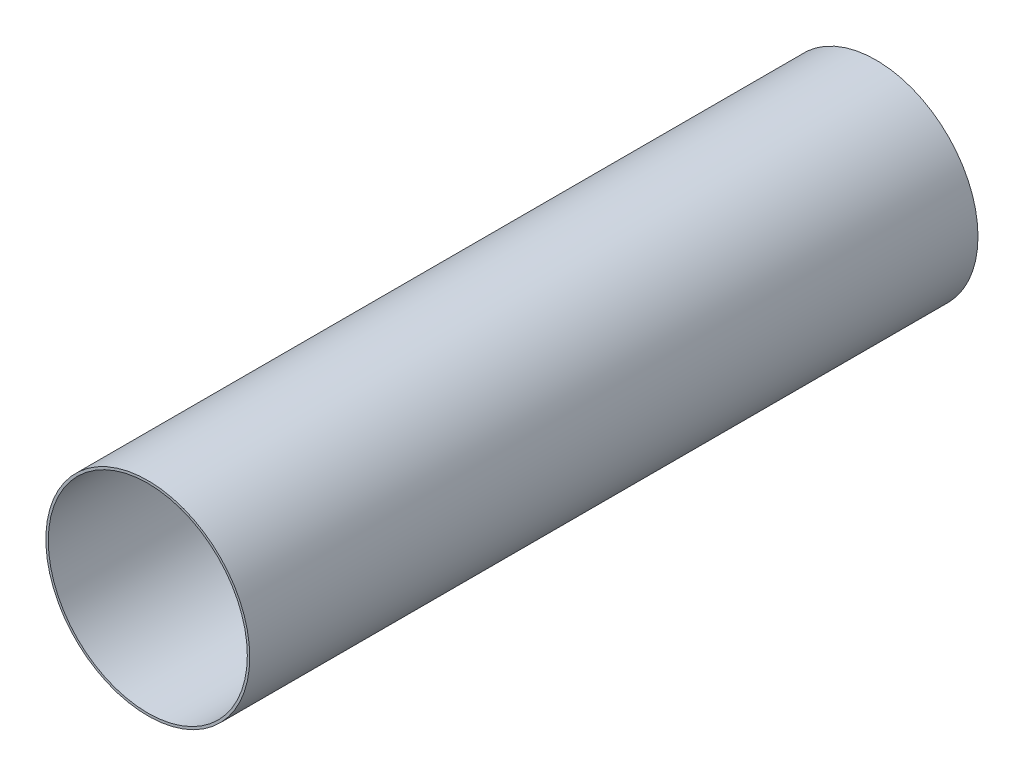
from build123d import *

# Parameters (mm, degrees)
CROQUIS1_R              = 2.1
CROQUIS1_R_2            = 2.05
SALIENTE_EXTRUIR1_DEPTH = 15


with BuildPart() as part:
    # Croquis1 → Saliente-Extruir1 (new body)
    with BuildSketch(Plane.XY):
        Circle(CROQUIS1_R)
        Circle(CROQUIS1_R_2, mode=Mode.SUBTRACT)
    extrude(amount=SALIENTE_EXTRUIR1_DEPTH)


solid = part.part
